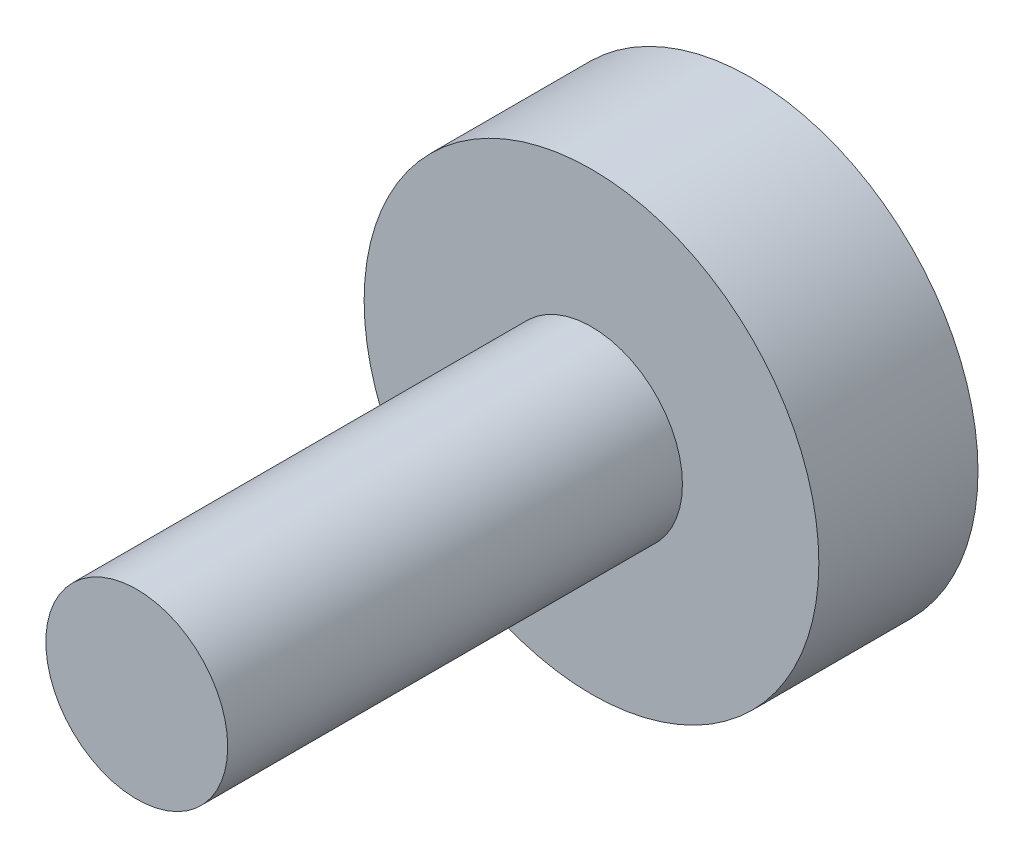
from build123d import *

# Parameters (mm, degrees)
SKETCH1_R           = 10
BOSS_EXTRUDE1_DEPTH = 7
SKETCH3_R           = 4
BOSS_EXTRUDE2_DEPTH = 20


with BuildPart() as part:
    # Sketch1 → Boss-Extrude1 (new body)
    with BuildSketch(Plane.XY):
        Circle(SKETCH1_R)
    extrude(amount=BOSS_EXTRUDE1_DEPTH)

    # Sketch3 → Boss-Extrude2 (add)
    with BuildSketch(Plane.XY.offset(7)):
        Circle(SKETCH3_R)
    extrude(amount=BOSS_EXTRUDE2_DEPTH)


solid = part.part
